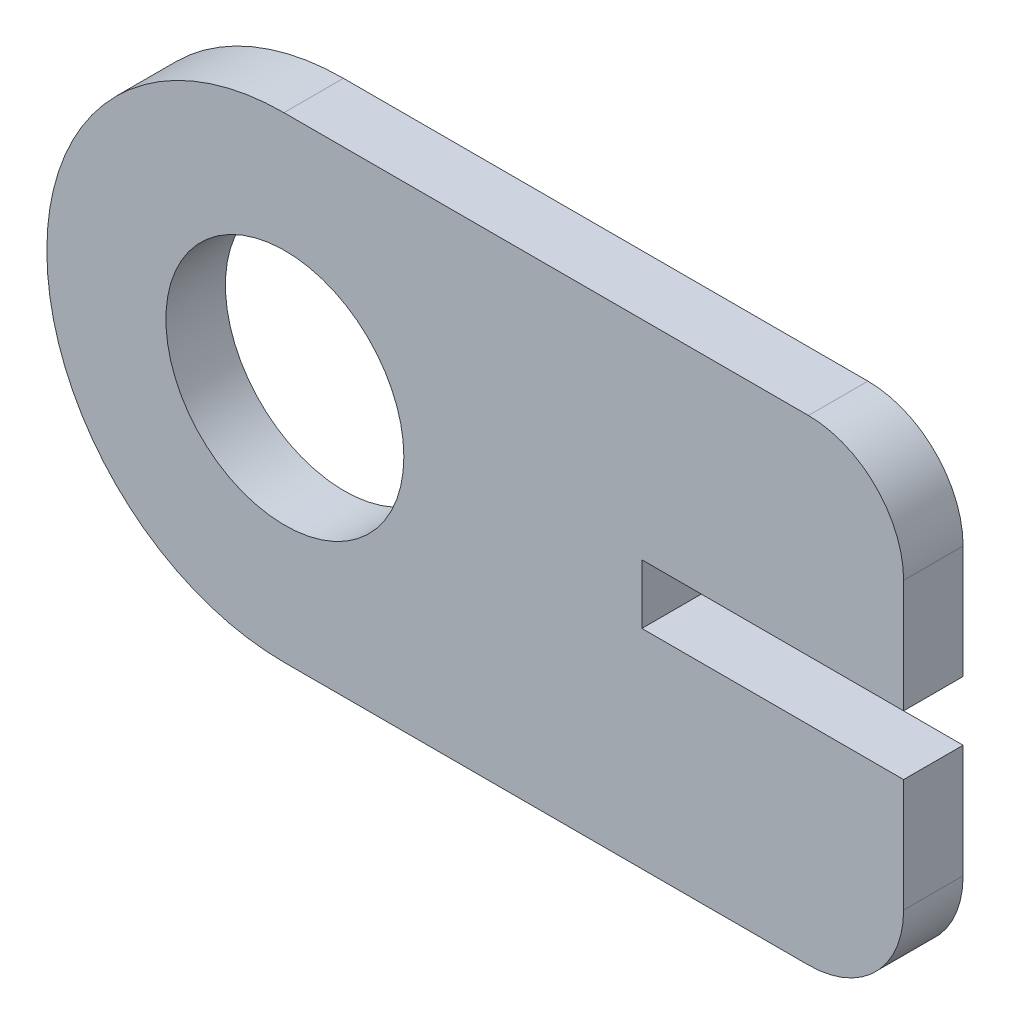
from build123d import *

# Parameters (mm, degrees)
SKETCH1_R           = 3.175
BOSS_EXTRUDE1_DEPTH = 1.5875


with BuildPart() as part:
    # Sketch1 → Boss-Extrude1 (new body)
    with BuildSketch(Plane.XY):
        with BuildLine():
            Line((-0.0254, 6.35), (13.97, 6.35))
            ThreePointArc((13.97, 6.35), (15.766051224, 5.606051224), (16.51, 3.81))
            Line((16.51, 3.81), (16.51, 0.79375))
            Line((16.51, 0.79375), (9.525, 0.79375))
            Line((9.525, 0.79375), (9.525, -0.79375))
            Line((9.525, -0.79375), (16.51, -0.79375))
            Line((16.51, -0.79375), (16.51, -3.81))
            ThreePointArc((16.51, -3.81), (15.766051224, -5.606051224), (13.97, -6.35))
            Line((13.97, -6.35), (-0.0254, -6.35))
            ThreePointArc((-0.0254, -6.35), (-4.497567548, -4.497567548), (-6.35, -0.0254))
            Line((-6.35, -0.0254), (-6.35, 0.0254))
            ThreePointArc((-6.35, 0.0254), (-4.497567548, 4.497567548), (-0.0254, 6.35))
        make_face()
        Circle(SKETCH1_R, mode=Mode.SUBTRACT)
    extrude(amount=BOSS_EXTRUDE1_DEPTH)


solid = part.part
